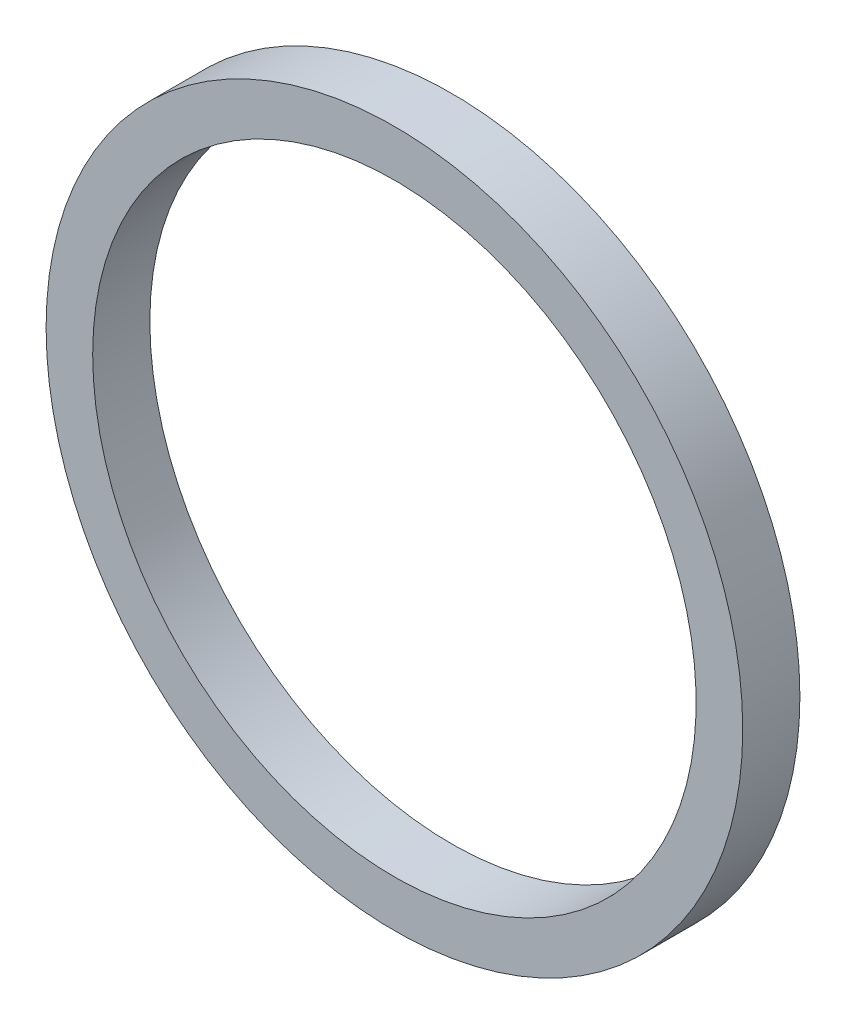
from build123d import *

# Parameters (mm, degrees)
SKETCH1_R           = 16.45
SKETCH1_R_2         = 14.25
BOSS_EXTRUDE1_DEPTH = 2.7


with BuildPart() as part:
    # Sketch1 → Boss-Extrude1 (new body)
    with BuildSketch(Plane.XY):
        Circle(SKETCH1_R)
        Circle(SKETCH1_R_2, mode=Mode.SUBTRACT)
    extrude(amount=BOSS_EXTRUDE1_DEPTH)


solid = part.part
